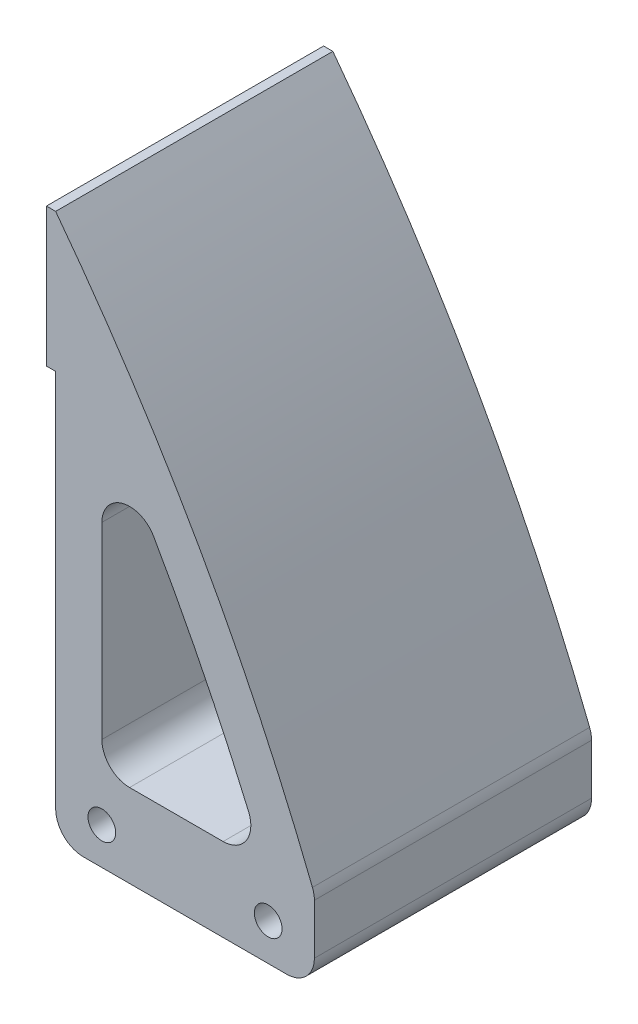
from build123d import *

# Parameters (mm, degrees)
SKETCH_1_W          = 1
SKETCH_1_H          = 15
SKETCH_1_W_2        = 28
SKETCH_1_H_2        = 12
SKETCH_1_R          = 1.5
EXTRUDE_1_DEPTH     = 30
FILLET_1_R          = 3
CUT_EXTRUDE_1_DEPTH = 66.276335681
FILLET_2_R          = 3


with BuildPart() as part:
    # 草图1 → 凸台-拉伸1 (new body)
    # profile 1 of 3: a face of its own
    with BuildSketch(Plane.XY):
        with BuildLine():
            Line((-14, 41), (-14, 6))
            Line((-14, 6), (-9, 6))
            Line((-9, 6), (-9, 40.097477255))
            ThreePointArc((-9, 40.097477255), (0.609436103, 23.461990889), (8.619401339, 6))
            Line((8.619401339, 6), (14, 6))
            ThreePointArc((14, 6), (1.713554205, 31.959590355), (-14, 56))
            Line((-14, 56), (-14, 41))
        make_face()
    # profile 2 of 3: a face of its own
    with BuildSketch(Plane.XY):
        with Locations((-14.5, 48.5)):
            Rectangle(SKETCH_1_W, SKETCH_1_H)
    # profile 3 of 3: a face of its own
    with BuildSketch(Plane.XY):
        Rectangle(SKETCH_1_W_2, SKETCH_1_H_2)
        with Locations((-9, 1)):
            Circle(SKETCH_1_R, mode=Mode.SUBTRACT)
        with Locations((9, 1)):
            Circle(SKETCH_1_R, mode=Mode.SUBTRACT)
    extrude(amount=EXTRUDE_1_DEPTH)

    # 圆角1
    fillet_1_edges = [part.edges().sort_by_distance(p)[0] for p in [
        (-9, 6, 15),
        (8.619401339, 6, 15),
        (-9, 40.097477255, 15),
        (14, -6, 15),
        (-14, -6, 15),
    ]]
    fillet(fillet_1_edges, radius=FILLET_1_R)

    # 草图2 → 切除-拉伸1 (cut, through all)
    with BuildSketch(Plane.XY.offset(30)):
        with BuildLine():
            Line((-14, -3), (14, -3))
            ThreePointArc((14, -3), (13.121320344, -5.121320344), (11, -6))
            Line((11, -6), (-11, -6))
            ThreePointArc((-11, -6), (-13.121320344, -5.121320344), (-14, -3))
        make_face()
    extrude(amount=-CUT_EXTRUDE_1_DEPTH, mode=Mode.SUBTRACT)

    # 圆角2
    fillet_2_edges = [part.edges().sort_by_distance(p)[0] for p in [
        (14, 6, 15),
        (14, -3, 15),
        (-14, -3, 15),
    ]]
    fillet(fillet_2_edges, radius=FILLET_2_R)


solid = part.part
